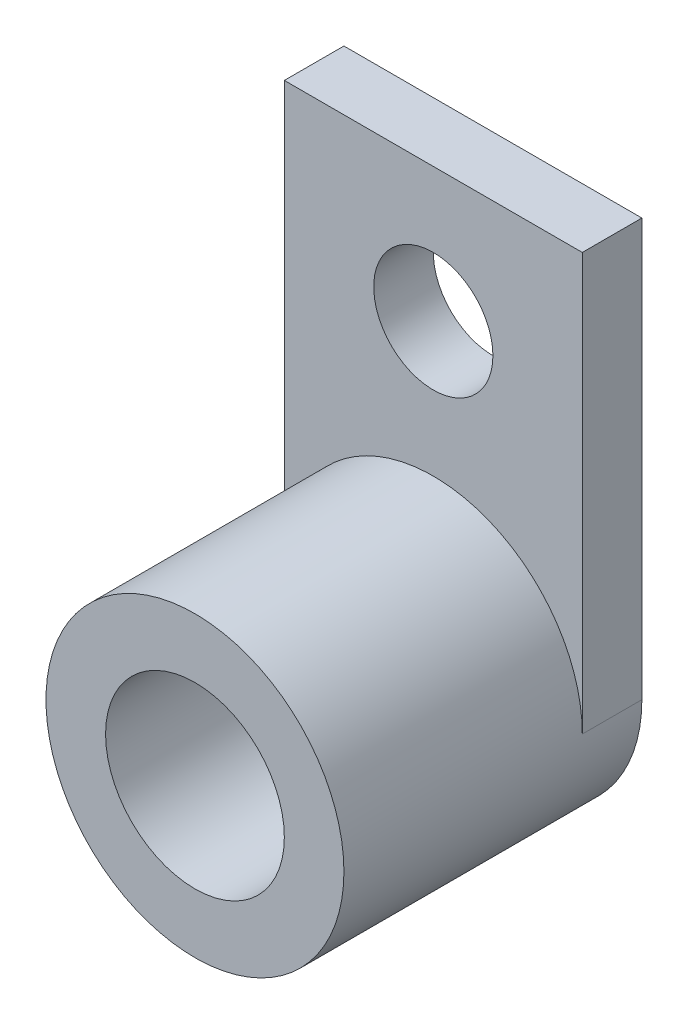
from build123d import *

# Parameters (mm, degrees)
SKETCH3_R           = 63.5
SKETCH3_R_2         = 38.1
BOSS_EXTRUDE1_DEPTH = 127
SKETCH4_R           = 38.1
SKETCH4_R_2         = 25.4
BOSS_EXTRUDE2_DEPTH = 25.4


with BuildPart() as part:
    # Sketch3 → Boss-Extrude1 (new body)
    with BuildSketch(Plane(origin=(0, 0, 0), x_dir=(0, 1, 0), z_dir=(0, 0, 1))):
        with Locations(Location((0, 0, 0), (0, 0, 270))):
            Circle(SKETCH3_R)
        with Locations(Location((0, 0, 0), (0, 0, 270))):
            Circle(SKETCH3_R_2, mode=Mode.SUBTRACT)
    extrude(amount=BOSS_EXTRUDE1_DEPTH)

    # Sketch4 → Boss-Extrude2 (add)
    with BuildSketch(Plane(origin=(0, 0, 0), x_dir=(0, 1, 0), z_dir=(0, 0, 1))):
        with BuildLine():
            Line((0, 63.5), (177.8, 63.5))
            Line((177.8, 63.5), (177.8, -63.5))
            Line((177.8, -63.5), (0, -63.5))
            ThreePointArc((0, -63.5), (-63.5, 0), (0, 63.5))
        make_face()
        with Locations(Location((0, 0, 0), (0, 0, 270))):
            Circle(SKETCH4_R, mode=Mode.SUBTRACT)
        with Locations(Location((120.65, 0, 0), (0, 0, 270))):
            Circle(SKETCH4_R_2, mode=Mode.SUBTRACT)
    extrude(amount=BOSS_EXTRUDE2_DEPTH)


solid = part.part
